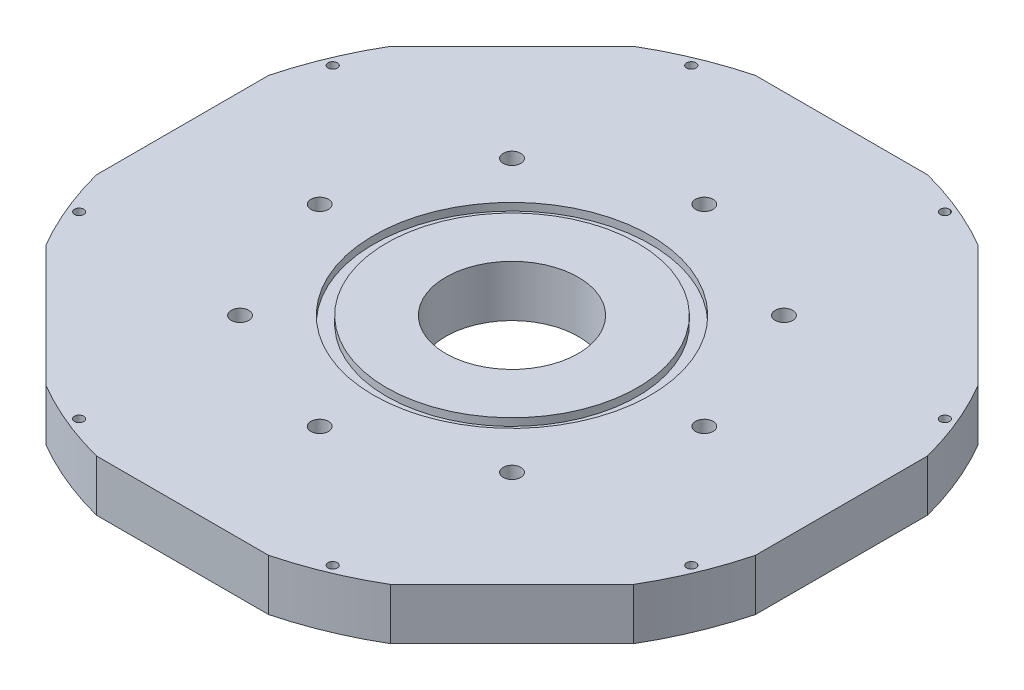
from build123d import *

# Parameters (mm, degrees)
BOSS_EXTRUDE1_DEPTH = 19.05
SKETCH3_R           = 24.5745
CUT_EXTRUDE1_DEPTH  = 175.004260005
SKETCH5_R           = 51.3715
SKETCH5_R_2         = 46.5455
CUT_EXTRUDE2_DEPTH  = 2.794
SKETCH19_R          = 1.7272
CUT_EXTRUDE4_DEPTH  = 175.004260005
CIRPATTERN2_COUNT   = 8
SKETCH37_R          = 119.0625
SKETCH37_R_2        = 115.2525
CUT_EXTRUDE7_DEPTH  = 2.667
CIRPATTERN4_COUNT   = 8


with BuildPart() as part:
    # Sketch1 → Boss-Extrude1 (new body)
    with BuildSketch(Plane(origin=(0, 0, 0), x_dir=(1, 0, 0), z_dir=(0, 1, 0))):
        with BuildLine():
            ThreePointArc((-31.932272077, 122.3), (-48.371185851, 116.778372909), (-63.899633215, 109.058685463))
            Line((-63.899633215, 109.058685463), (-109.058685463, 63.899633215))
            ThreePointArc((-109.058685463, 63.899633215), (-116.778372909, 48.371185851), (-122.3, 31.932272077))
            Line((-122.3, 31.932272077), (-122.3, -31.932272077))
            ThreePointArc((-122.3, -31.932272077), (-116.778372909, -48.371185851), (-109.058685463, -63.899633215))
            Line((-109.058685463, -63.899633215), (-63.899633215, -109.058685463))
            ThreePointArc((-63.899633215, -109.058685463), (-48.371185851, -116.778372909), (-31.932272077, -122.3))
            Line((-31.932272077, -122.3), (31.932272077, -122.3))
            ThreePointArc((31.932272077, -122.3), (48.371185851, -116.778372909), (63.899633215, -109.058685463))
            Line((63.899633215, -109.058685463), (109.058685463, -63.899633215))
            ThreePointArc((109.058685463, -63.899633215), (116.778372909, -48.371185851), (122.3, -31.932272077))
            Line((122.3, -31.932272077), (122.3, 31.932272077))
            ThreePointArc((122.3, 31.932272077), (116.778372909, 48.371185851), (109.058685463, 63.899633215))
            Line((109.058685463, 63.899633215), (63.899633215, 109.058685463))
            ThreePointArc((63.899633215, 109.058685463), (48.371185851, 116.778372909), (31.932272077, 122.3))
            Line((31.932272077, 122.3), (-31.932272077, 122.3))
        make_face()
    extrude(amount=BOSS_EXTRUDE1_DEPTH)

    # Sketch3 → Cut-Extrude1 (cut, through all)
    with BuildSketch(Plane(origin=(0, 19.05, 0), x_dir=(1, 0, 0), z_dir=(0, 1, 0))):
        with Locations(Location((0, 0, 0), (0, 0, 270))):
            Circle(SKETCH3_R)
    extrude(amount=-CUT_EXTRUDE1_DEPTH, mode=Mode.SUBTRACT)

    # Sketch5 → Cut-Extrude2 (cut)
    with BuildSketch(Plane(origin=(0, 19.05, 0), x_dir=(1, 0, 0), z_dir=(0, 1, 0))):
        with Locations(Location((0, 0, 0), (0, 0, 270))):
            Circle(SKETCH5_R)
        with Locations(Location((0, 0, 0), (0, 0, 270))):
            Circle(SKETCH5_R_2, mode=Mode.SUBTRACT)
    extrude(amount=-CUT_EXTRUDE2_DEPTH, mode=Mode.SUBTRACT)

    # Sketch19 → Cut-Extrude4 (cut, through all)
    with BuildSketch(Plane(origin=(0, 19.05, 0), x_dir=(1, 0, 0), z_dir=(0, 1, 0))):
        with Locations(Location((-47.055461432, 113.601933173, 0), (0, 0, 270))):
            Circle(SKETCH19_R)
    cut_extrude4 = extrude(amount=-CUT_EXTRUDE4_DEPTH, mode=Mode.SUBTRACT)

    # CirPattern2: Cut-Extrude4 ×8 about axis
    cirpattern2_axis = Axis((0, 0, 0), (0, 1, 0))
    for i in range(1, CIRPATTERN2_COUNT):
        add(cut_extrude4.rotate(cirpattern2_axis, i * 360 / CIRPATTERN2_COUNT), mode=Mode.SUBTRACT)

    # Sketch23 → 5/16-18 Tapped Hole2 (revolve, cut)
    with BuildSketch(Plane(origin=(-71.374, 19.05, 0), x_dir=(0, 0, 1), z_dir=(1, 0, 0))):
        Polygon((0, 0), (0, 14.661148974), (3.2639, 12.7), (3.2639, 0), align=None)
    f_5_16_18_tapped_hole2 = revolve(axis=Axis((-71.374, 25.4, 0), (0, -1, 0)), mode=Mode.SUBTRACT)

    # Sketch37 → Cut-Extrude7 (cut)
    with BuildSketch(Plane.XZ):
        with Locations(Location((0, 0, 0), (0, 0, 270))):
            Circle(SKETCH37_R)
        with Locations(Location((0, 0, 0), (0, 0, 270))):
            Circle(SKETCH37_R_2, mode=Mode.SUBTRACT)
    extrude(amount=-CUT_EXTRUDE7_DEPTH, mode=Mode.SUBTRACT)

    # CirPattern4: 5/16-18 Tapped Hole2 ×8 about axis
    cirpattern4_axis = Axis((0, 0, 0), (0, 1, 0))
    for i in range(1, CIRPATTERN4_COUNT):
        add(f_5_16_18_tapped_hole2.rotate(cirpattern4_axis, i * 360 / CIRPATTERN4_COUNT), mode=Mode.SUBTRACT)


solid = part.part
